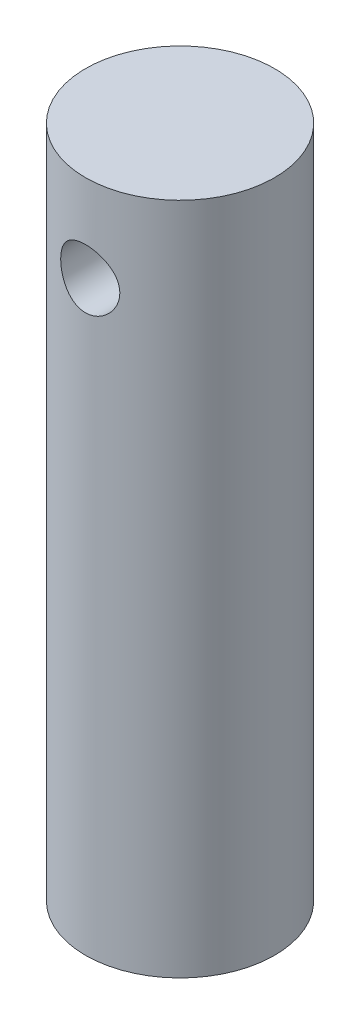
from build123d import *

# Parameters (mm, degrees)
SKETCH1_R               = 10.16
BOSS_EXTRUDE1_DEPTH     = 72.39
CUT_EXTRUDE1_DEPTH      = 74.802190347
CUT_EXTRUDE1_DEPTH_BACK = 74.802190347
SKETCH2_R               = 3.175


with BuildPart() as part:
    # Sketch1 → Boss-Extrude1 (new body)
    with BuildSketch(Plane(origin=(0, 0, 0), x_dir=(1, 0, 0), z_dir=(0, 1, 0))):
        with Locations(Location((0, 0, 0), (0, 0, 270))):
            Circle(SKETCH1_R)
    extrude(amount=BOSS_EXTRUDE1_DEPTH)

    # Sketch2 → Cut-Extrude1 (cut, two sides: drawn at the far end of the back side and taken through both)
    with BuildSketch(Plane.XY.offset(-CUT_EXTRUDE1_DEPTH_BACK)):
        with Locations(Location((0, 62.992, 0), (0, 0, 89.99999999))):
            Circle(SKETCH2_R)
    extrude(amount=CUT_EXTRUDE1_DEPTH + CUT_EXTRUDE1_DEPTH_BACK, mode=Mode.SUBTRACT)


solid = part.part
